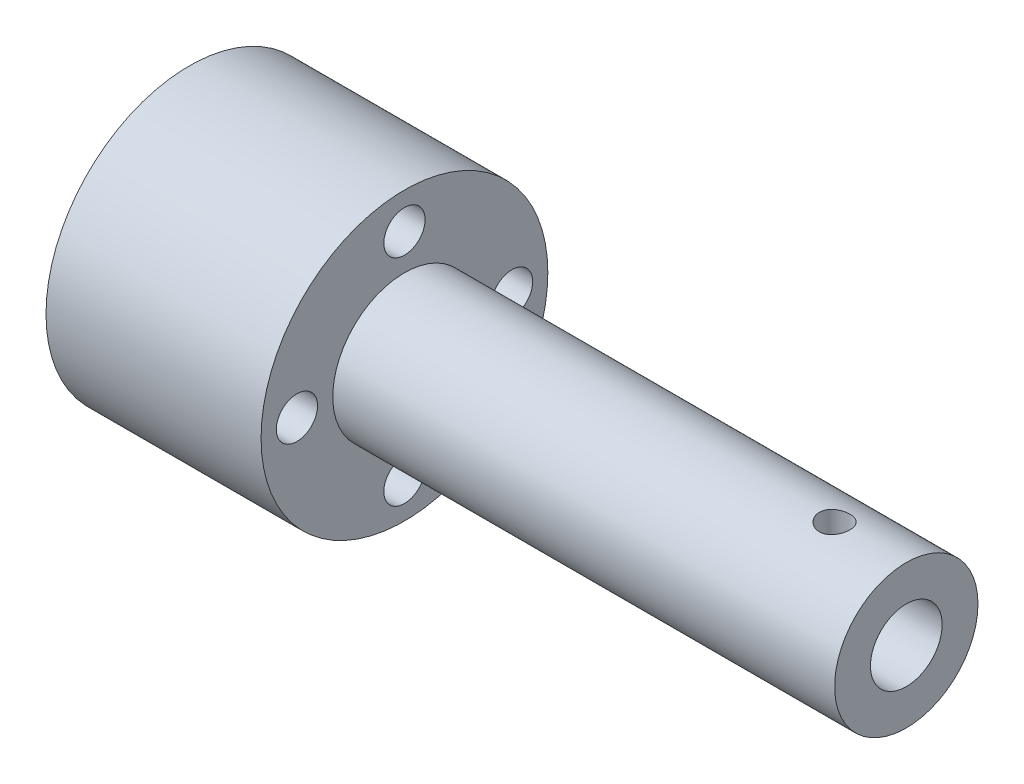
from build123d import *

# Parameters (mm, degrees)
SKETCH1_R           = 12.7
BOSS_EXTRUDE1_DEPTH = 31.75
SKETCH2_R           = 3.175
CUT_EXTRUDE1_DEPTH  = 15.875
SKETCH3_R           = 12.7
SKETCH3_R_2         = 6.35
CUT_EXTRUDE2_DEPTH  = 44.45
SKETCH8_W           = 1.35255
SKETCH8_H           = 12.7
SKETCH4_R           = 1.8288
CUT_EXTRUDE3_DEPTH  = 48.941448757
SKETCH10_R          = 2.921
CUT_EXTRUDE5_DEPTH  = 9.525
CIRPATTERN1_COUNT   = 4


with BuildPart() as part:
    # Sketch1 → Boss-Extrude1 (new, symmetric)
    with BuildSketch(Plane(origin=(0, 0, 0), x_dir=(0, 0, -1), z_dir=(1, 0, 0))):
        Circle(SKETCH1_R)
    extrude(amount=BOSS_EXTRUDE1_DEPTH, both=True)

    # Sketch2 → Cut-Extrude1 (cut)
    with BuildSketch(Plane(origin=(31.75, 0, 0), x_dir=(0, 0, -1), z_dir=(1, 0, 0))):
        Circle(SKETCH2_R)
    extrude(amount=-CUT_EXTRUDE1_DEPTH, mode=Mode.SUBTRACT)

    # Sketch3 → Cut-Extrude2 (cut)
    with BuildSketch(Plane(origin=(31.75, 0, 0), x_dir=(0, 0, -1), z_dir=(1, 0, 0))):
        Circle(SKETCH3_R)
        Circle(SKETCH3_R_2, mode=Mode.SUBTRACT)
    extrude(amount=-CUT_EXTRUDE2_DEPTH, mode=Mode.SUBTRACT)

    # Sketch8 → #6-32 Tapped Hole2 (revolve, cut)
    with BuildSketch(Plane(origin=(25.4, 0, 0), x_dir=(0, 0, -1), z_dir=(1, 0, 0))):
        with Locations((0.676275, 6.35)):
            Rectangle(SKETCH8_W, SKETCH8_H)
    revolve(axis=Axis((25.4, -6.35, 0), (0, 1, 0)), mode=Mode.SUBTRACT)

    # Sketch4 → Cut-Extrude3 (cut, through all)
    with BuildSketch(Plane(origin=(-12.7, 0, 0), x_dir=(0, 0, -1), z_dir=(1, 0, 0))):
        with Locations((9.525, 0)):
            Circle(SKETCH4_R)
    cut_extrude3 = extrude(amount=-CUT_EXTRUDE3_DEPTH, mode=Mode.SUBTRACT)

    # Sketch10 → Cut-Extrude5 (cut)
    with BuildSketch(Plane.ZY.offset(31.75)):
        with Locations((-9.525, 0)):
            Circle(SKETCH10_R)
    cut_extrude5 = extrude(amount=-CUT_EXTRUDE5_DEPTH, mode=Mode.SUBTRACT)

    # CirPattern1: Cut-Extrude3, Cut-Extrude5 ×4 about axis
    cirpattern1_axis = Axis((0, 0, 0), (1, 0, 0))
    add([cut_extrude3.rotate(cirpattern1_axis, i * 360 / CIRPATTERN1_COUNT) for i in range(1, CIRPATTERN1_COUNT)], mode=Mode.SUBTRACT)
    add([cut_extrude5.rotate(cirpattern1_axis, i * 360 / CIRPATTERN1_COUNT) for i in range(1, CIRPATTERN1_COUNT)], mode=Mode.SUBTRACT)


solid = part.part
